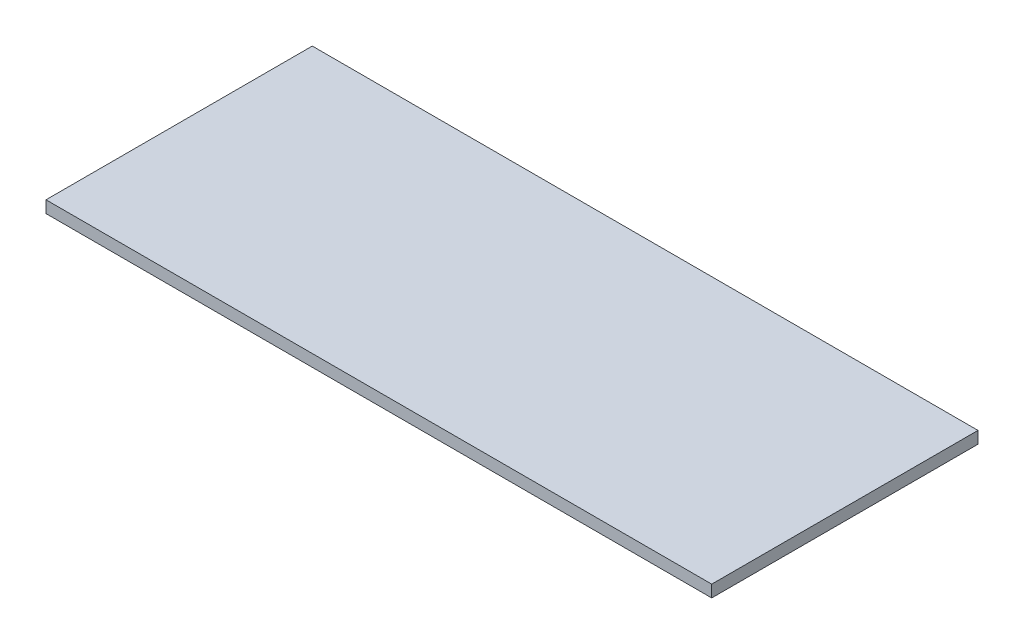
from build123d import *

# Parameters (mm, degrees)
ESQUISSE1_W        = 1000
ESQUISSE1_H        = 400
BOSS_EXTRU_1_DEPTH = 18


with BuildPart() as part:
    # Esquisse1 → Boss.-Extru.1 (new body)
    with BuildSketch(Plane(origin=(0, 0, 0), x_dir=(1, 0, 0), z_dir=(0, 1, 0))):
        Rectangle(ESQUISSE1_W, ESQUISSE1_H)
    extrude(amount=BOSS_EXTRU_1_DEPTH)


solid = part.part
